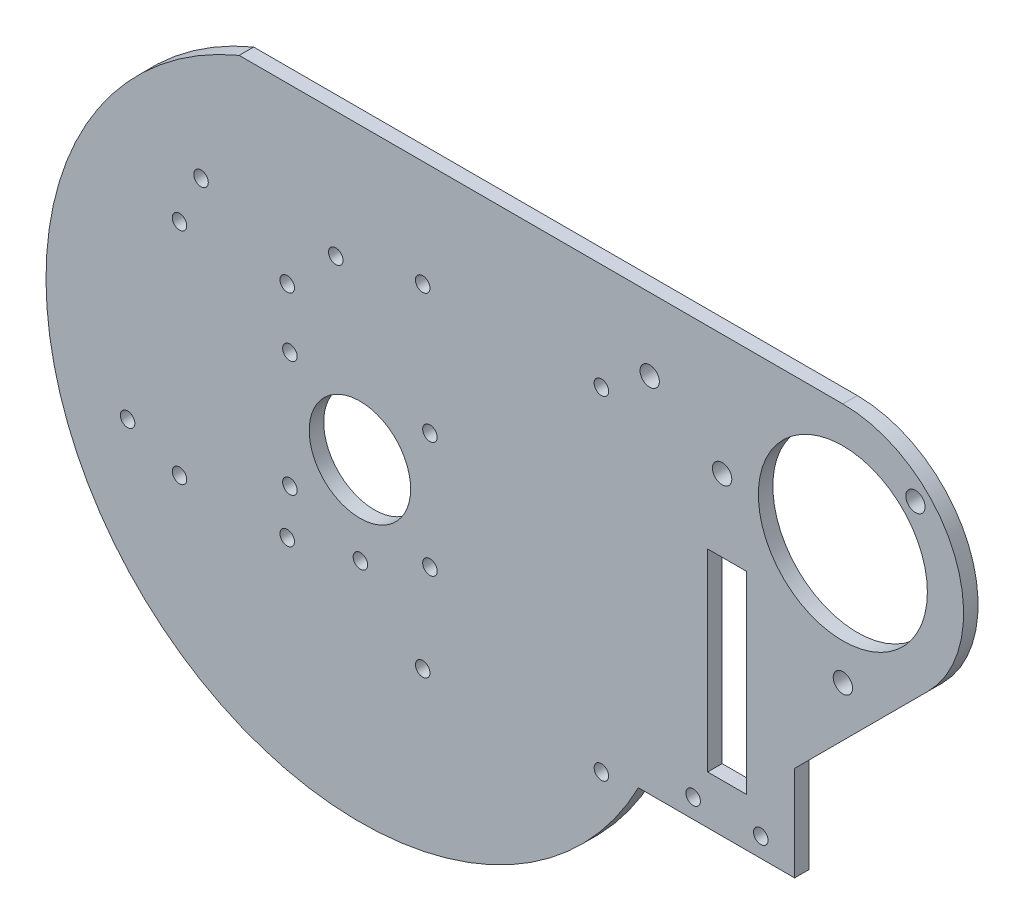
from build123d import *

# Parameters (mm, degrees)
SKETCH1_R           = 10.5
SKETCH1_R_2         = 1.5
SKETCH1_W           = 8
SKETCH1_H           = 40
SKETCH1_R_3         = 17.5
BOSS_EXTRUDE1_DEPTH = 3
CUT_EXTRUDE1_REACH  = 140.687
SKETCH2_R           = 2
CUT_EXTRUDE2_REACH  = 140.687
SKETCH3_R           = 2
BOSS_EXTRUDE2_START = -3
SKETCH4_R           = 65
SKETCH4_R_2         = 60
BOSS_EXTRUDE2_DEPTH = 3
CUT_EXTRUDE3_START  = -10
CUT_EXTRUDE3_DEPTH  = 10
CUT_EXTRUDE4_START  = -10
CUT_EXTRUDE4_DEPTH  = 10
CUT_EXTRUDE5_REACH  = 142.922
SKETCH7_R           = 1.5
CUT_EXTRUDE6_REACH  = 142.922
SKETCH8_R           = 1.5
CUT_EXTRUDE7_REACH  = 142.922
SKETCH9_R           = 1.5


with BuildPart() as part:
    # Sketch1 → Boss-Extrude1 (new body)
    # profile 1 of 2: a face of its own
    with BuildSketch(Plane.XY):
        with BuildLine():
            ThreePointArc((-60, 0), (-52.867640737, 28.372743309), (-33.166247904, 50))
            Line((-33.166247904, 50), (-60, 50))
            Line((-60, 50), (-60, 0))
        make_face()
    # profile 2 of 2: a face of its own
    with BuildSketch(Plane.XY):
        with BuildLine():
            ThreePointArc((0, 60), (-17.320508076, 57.445626465), (-33.166247904, 50))
            ThreePointArc((-33.166247904, 50), (-52.867640737, 28.372743309), (-60, 0))
            ThreePointArc((-60, 0), (-15.529142706, -57.955549577), (51.961524227, -30))
            Line((51.961524227, -30), (56.568542495, -30))
            Line((56.568542495, -30), (90, -30))
            Line((90, -30), (90, -10.355339059))
            Line((90, -10.355339059), (117.67766953, 17.32233047))
            ThreePointArc((117.67766953, 17.32233047), (123.096988313, 44.567085809), (100, 60))
            Line((100, 60), (0, 60))
        make_face()
        Circle(SKETCH1_R, mode=Mode.SUBTRACT)
        with Locations((69, -26)):
            Circle(SKETCH1_R_2, mode=Mode.SUBTRACT)
        with Locations((76, 0)):
            Rectangle(SKETCH1_W, SKETCH1_H, mode=Mode.SUBTRACT)
        with Locations((83, -26)):
            Circle(SKETCH1_R_2, mode=Mode.SUBTRACT)
        with Locations((100, 35)):
            Circle(SKETCH1_R_3, mode=Mode.SUBTRACT)
    extrude(amount=BOSS_EXTRUDE1_DEPTH)

    # Sketch2 → Cut-Extrude1 (cut, up to next)
    with BuildSketch(Plane.XY.offset(3), mode=Mode.PRIVATE) as cut_extrude1_sk1:
        with Locations((60, 45)):
            Circle(SKETCH2_R)
    cut_extrude1_tool1 = extrude(cut_extrude1_sk1.sketch, amount=-CUT_EXTRUDE1_REACH, mode=Mode.PRIVATE) & part.part
    add(cut_extrude1_tool1.solids().sort_by_distance((60, 45, 3))[0], mode=Mode.SUBTRACT)

    # Sketch3 → Cut-Extrude2 (cut, up to next)
    with BuildSketch(Plane.XY.offset(3), mode=Mode.PRIVATE) as cut_extrude2_sk1:
        with Locations((100, 10)):
            Circle(SKETCH3_R)
    cut_extrude2_tool1 = extrude(cut_extrude2_sk1.sketch, amount=-CUT_EXTRUDE2_REACH, mode=Mode.PRIVATE) & part.part
    # Sketch3 → Cut-Extrude2 (cut, up to next)
    with BuildSketch(Plane.XY.offset(3), mode=Mode.PRIVATE) as cut_extrude2_sk2:
        with Locations((75, 35)):
            Circle(SKETCH3_R)
    cut_extrude2_tool2 = extrude(cut_extrude2_sk2.sketch, amount=-CUT_EXTRUDE2_REACH, mode=Mode.PRIVATE) & part.part
    # Sketch3 → Cut-Extrude2 (cut, up to next)
    with BuildSketch(Plane.XY.offset(3), mode=Mode.PRIVATE) as cut_extrude2_sk3:
        with Locations((115.0260191, 50.0260191)):
            Circle(SKETCH3_R)
    cut_extrude2_tool3 = extrude(cut_extrude2_sk3.sketch, amount=-CUT_EXTRUDE2_REACH, mode=Mode.PRIVATE) & part.part
    add(cut_extrude2_tool1.solids().sort_by_distance((100, 10, 3))[0], mode=Mode.SUBTRACT)
    add(cut_extrude2_tool2.solids().sort_by_distance((75, 35, 3))[0], mode=Mode.SUBTRACT)
    add(cut_extrude2_tool3.solids().sort_by_distance((115.026019, 50.026019, 3))[0], mode=Mode.SUBTRACT)

    # Sketch4 → Boss-Extrude2 (add)
    with BuildSketch(Plane.XY.offset(3).offset(BOSS_EXTRUDE2_START)):
        Circle(SKETCH4_R)
        Circle(SKETCH4_R_2, mode=Mode.SUBTRACT)
    extrude(amount=BOSS_EXTRUDE2_DEPTH)

    # Sketch5 → Cut-Extrude3 (cut)
    with BuildSketch(Plane.XY.offset(3).offset(CUT_EXTRUDE3_START)):
        with BuildLine():
            Line((-60, 50), (-41.533119315, 50))
            ThreePointArc((-41.533119315, 50), (-52.282822987, 38.62002616), (-60, 25))
            Line((-60, 25), (-60, 50))
        make_face()
    extrude(amount=CUT_EXTRUDE3_DEPTH, mode=Mode.SUBTRACT)

    # Sketch6 → Cut-Extrude4 (cut)
    with BuildSketch(Plane.XY.offset(3).offset(CUT_EXTRUDE4_START)):
        with BuildLine():
            Line((25, 60), (-25, 60))
            ThreePointArc((-25, 60), (0, 65), (25, 60))
        make_face()
    extrude(amount=CUT_EXTRUDE4_DEPTH, mode=Mode.SUBTRACT)

    # Sketch7 → Cut-Extrude5 (cut, up to next)
    with BuildSketch(Plane.XY.offset(3), mode=Mode.PRIVATE) as cut_extrude5_sk1:
        with Locations((-14.5, 12)):
            Circle(SKETCH7_R)
    cut_extrude5_tool1 = extrude(cut_extrude5_sk1.sketch, amount=-CUT_EXTRUDE5_REACH, mode=Mode.PRIVATE) & part.part
    # Sketch7 → Cut-Extrude5 (cut, up to next)
    with BuildSketch(Plane.XY.offset(3), mode=Mode.PRIVATE) as cut_extrude5_sk2:
        with Locations((14.5, 12)):
            Circle(SKETCH7_R)
    cut_extrude5_tool2 = extrude(cut_extrude5_sk2.sketch, amount=-CUT_EXTRUDE5_REACH, mode=Mode.PRIVATE) & part.part
    # Sketch7 → Cut-Extrude5 (cut, up to next)
    with BuildSketch(Plane.XY.offset(3), mode=Mode.PRIVATE) as cut_extrude5_sk3:
        with Locations((-14.5, -12)):
            Circle(SKETCH7_R)
    cut_extrude5_tool3 = extrude(cut_extrude5_sk3.sketch, amount=-CUT_EXTRUDE5_REACH, mode=Mode.PRIVATE) & part.part
    # Sketch7 → Cut-Extrude5 (cut, up to next)
    with BuildSketch(Plane.XY.offset(3), mode=Mode.PRIVATE) as cut_extrude5_sk4:
        with Locations((14.5, -12)):
            Circle(SKETCH7_R)
    cut_extrude5_tool4 = extrude(cut_extrude5_sk4.sketch, amount=-CUT_EXTRUDE5_REACH, mode=Mode.PRIVATE) & part.part
    add(cut_extrude5_tool1.solids().sort_by_distance((-14.5, 12, 3))[0], mode=Mode.SUBTRACT)
    add(cut_extrude5_tool2.solids().sort_by_distance((14.5, 12, 3))[0], mode=Mode.SUBTRACT)
    add(cut_extrude5_tool3.solids().sort_by_distance((-14.5, -12, 3))[0], mode=Mode.SUBTRACT)
    add(cut_extrude5_tool4.solids().sort_by_distance((14.5, -12, 3))[0], mode=Mode.SUBTRACT)

    # Sketch8 → Cut-Extrude6 (cut, up to next)
    with BuildSketch(Plane.XY.offset(3), mode=Mode.PRIVATE) as cut_extrude6_sk1:
        with Locations((50, 38)):
            Circle(SKETCH8_R)
    cut_extrude6_tool1 = extrude(cut_extrude6_sk1.sketch, amount=-CUT_EXTRUDE6_REACH, mode=Mode.PRIVATE) & part.part
    # Sketch8 → Cut-Extrude6 (cut, up to next)
    with BuildSketch(Plane.XY.offset(3), mode=Mode.PRIVATE) as cut_extrude6_sk2:
        with Locations((13, 38)):
            Circle(SKETCH8_R)
    cut_extrude6_tool2 = extrude(cut_extrude6_sk2.sketch, amount=-CUT_EXTRUDE6_REACH, mode=Mode.PRIVATE) & part.part
    # Sketch8 → Cut-Extrude6 (cut, up to next)
    with BuildSketch(Plane.XY.offset(3), mode=Mode.PRIVATE) as cut_extrude6_sk3:
        with Locations((50, -31)):
            Circle(SKETCH8_R)
    cut_extrude6_tool3 = extrude(cut_extrude6_sk3.sketch, amount=-CUT_EXTRUDE6_REACH, mode=Mode.PRIVATE) & part.part
    # Sketch8 → Cut-Extrude6 (cut, up to next)
    with BuildSketch(Plane.XY.offset(3), mode=Mode.PRIVATE) as cut_extrude6_sk4:
        with Locations((13, -31)):
            Circle(SKETCH8_R)
    cut_extrude6_tool4 = extrude(cut_extrude6_sk4.sketch, amount=-CUT_EXTRUDE6_REACH, mode=Mode.PRIVATE) & part.part
    # Sketch8 → Cut-Extrude6 (cut, up to next)
    with BuildSketch(Plane.XY.offset(3), mode=Mode.PRIVATE) as cut_extrude6_sk5:
        with Locations((-5, 34)):
            Circle(SKETCH8_R)
    cut_extrude6_tool5 = extrude(cut_extrude6_sk5.sketch, amount=-CUT_EXTRUDE6_REACH, mode=Mode.PRIVATE) & part.part
    # Sketch8 → Cut-Extrude6 (cut, up to next)
    with BuildSketch(Plane.XY.offset(3), mode=Mode.PRIVATE) as cut_extrude6_sk6:
        with Locations((-32.9, 34)):
            Circle(SKETCH8_R)
    cut_extrude6_tool6 = extrude(cut_extrude6_sk6.sketch, amount=-CUT_EXTRUDE6_REACH, mode=Mode.PRIVATE) & part.part
    # Sketch8 → Cut-Extrude6 (cut, up to next)
    with BuildSketch(Plane.XY.offset(3), mode=Mode.PRIVATE) as cut_extrude6_sk7:
        with Locations((0.1, -18.1)):
            Circle(SKETCH8_R)
    cut_extrude6_tool7 = extrude(cut_extrude6_sk7.sketch, amount=-CUT_EXTRUDE6_REACH, mode=Mode.PRIVATE) & part.part
    # Sketch8 → Cut-Extrude6 (cut, up to next)
    with BuildSketch(Plane.XY.offset(3), mode=Mode.PRIVATE) as cut_extrude6_sk8:
        with Locations((-48.1, -16.8)):
            Circle(SKETCH8_R)
    cut_extrude6_tool8 = extrude(cut_extrude6_sk8.sketch, amount=-CUT_EXTRUDE6_REACH, mode=Mode.PRIVATE) & part.part
    add(cut_extrude6_tool1.solids().sort_by_distance((50, 38, 3))[0], mode=Mode.SUBTRACT)
    add(cut_extrude6_tool2.solids().sort_by_distance((13, 38, 3))[0], mode=Mode.SUBTRACT)
    add(cut_extrude6_tool3.solids().sort_by_distance((50, -31, 3))[0], mode=Mode.SUBTRACT)
    add(cut_extrude6_tool4.solids().sort_by_distance((13, -31, 3))[0], mode=Mode.SUBTRACT)
    add(cut_extrude6_tool5.solids().sort_by_distance((-5, 34, 3))[0], mode=Mode.SUBTRACT)
    add(cut_extrude6_tool6.solids().sort_by_distance((-32.9, 34, 3))[0], mode=Mode.SUBTRACT)
    add(cut_extrude6_tool7.solids().sort_by_distance((0.1, -18.1, 3))[0], mode=Mode.SUBTRACT)
    add(cut_extrude6_tool8.solids().sort_by_distance((-48.1, -16.8, 3))[0], mode=Mode.SUBTRACT)

    # Sketch9 → Cut-Extrude7 (cut, up to next)
    with BuildSketch(Plane.XY.offset(3), mode=Mode.PRIVATE) as cut_extrude7_sk1:
        with Locations((-15.055022894, 24)):
            Circle(SKETCH9_R)
    cut_extrude7_tool1 = extrude(cut_extrude7_sk1.sketch, amount=-CUT_EXTRUDE7_REACH, mode=Mode.PRIVATE) & part.part
    # Sketch9 → Cut-Extrude7 (cut, up to next)
    with BuildSketch(Plane.XY.offset(3), mode=Mode.PRIVATE) as cut_extrude7_sk2:
        with Locations((-15.055022894, -21.5)):
            Circle(SKETCH9_R)
    cut_extrude7_tool2 = extrude(cut_extrude7_sk2.sketch, amount=-CUT_EXTRUDE7_REACH, mode=Mode.PRIVATE) & part.part
    # Sketch9 → Cut-Extrude7 (cut, up to next)
    with BuildSketch(Plane.XY.offset(3), mode=Mode.PRIVATE) as cut_extrude7_sk3:
        with Locations((-37.355022894, 24)):
            Circle(SKETCH9_R)
    cut_extrude7_tool3 = extrude(cut_extrude7_sk3.sketch, amount=-CUT_EXTRUDE7_REACH, mode=Mode.PRIVATE) & part.part
    # Sketch9 → Cut-Extrude7 (cut, up to next)
    with BuildSketch(Plane.XY.offset(3), mode=Mode.PRIVATE) as cut_extrude7_sk4:
        with Locations((-37.355022894, -21.5)):
            Circle(SKETCH9_R)
    cut_extrude7_tool4 = extrude(cut_extrude7_sk4.sketch, amount=-CUT_EXTRUDE7_REACH, mode=Mode.PRIVATE) & part.part
    add(cut_extrude7_tool1.solids().sort_by_distance((-15.055023, 24, 3))[0], mode=Mode.SUBTRACT)
    add(cut_extrude7_tool2.solids().sort_by_distance((-15.055023, -21.5, 3))[0], mode=Mode.SUBTRACT)
    add(cut_extrude7_tool3.solids().sort_by_distance((-37.355023, 24, 3))[0], mode=Mode.SUBTRACT)
    add(cut_extrude7_tool4.solids().sort_by_distance((-37.355023, -21.5, 3))[0], mode=Mode.SUBTRACT)


solid = part.part
